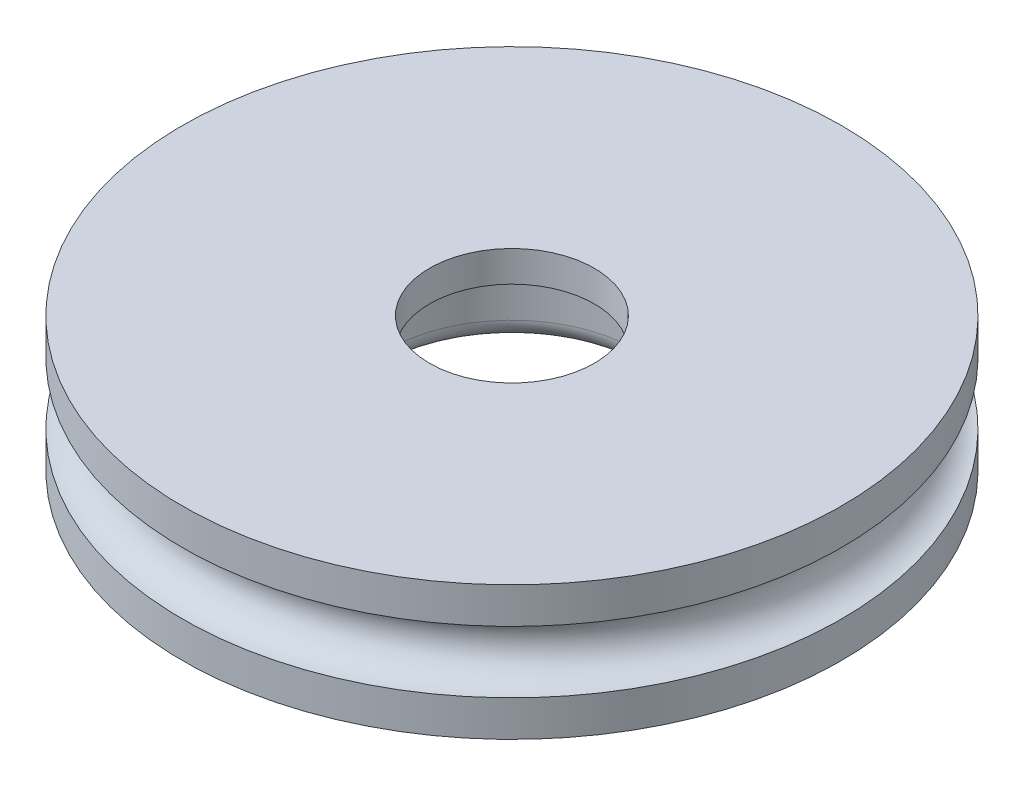
from build123d import *

# Parameters (mm, degrees)
SKETCH1_R           = 8
SKETCH1_R_2         = 3.05
BOSS_EXTRUDE1_DEPTH = 1.625
SKETCH3_R           = 3.5
SKETCH3_R_2         = 2
BOSS_EXTRUDE2_DEPTH = 0.75
SKETCH4_R           = 6.5
SKETCH4_R_2         = 3
CUT_EXTRUDE1_DEPTH  = 0.5
FILLET1_R           = 0.5


with BuildPart() as part:
    # Sketch1 → Boss-Extrude1 (new, symmetric)
    with BuildSketch(Plane(origin=(0, 0, 0), x_dir=(1, 0, 0), z_dir=(0, 1, 0))):
        with Locations(Location((0, 0, 0), (0, 0, 90))):
            Circle(SKETCH1_R)
        with Locations(Location((0, 0, 0), (0, 0, 90))):
            Circle(SKETCH1_R_2, mode=Mode.SUBTRACT)
    extrude(amount=BOSS_EXTRUDE1_DEPTH, both=True)

    # Sketch2 → Cut-Revolve1 (revolve, cut)
    with BuildSketch(Plane(origin=(0, 0, 0), x_dir=(0, 0, -1), z_dir=(1, 0, 0)), mode=Mode.PRIVATE) as cut_revolve1_sk:
        with BuildLine():
            Line((-8, 0.75), (-8, -0.75))
            ThreePointArc((-8, -0.75), (-7.25, 0), (-8, 0.75))
        make_face()
    revolve(cut_revolve1_sk.sketch.rotate(Axis((0, 1.625, 0), (0, -1, 0)), 180), axis=Axis((0, 1.625, 0), (0, -1, 0)), mode=Mode.SUBTRACT)

    # Sketch3 → Boss-Extrude2 (add)
    with BuildSketch(Plane(origin=(0, 1.625, 0), x_dir=(1, 0, 0), z_dir=(0, 1, 0))):
        Circle(SKETCH3_R)
        with Locations(Location((0, 0, 0), (0, 0, 270))):
            Circle(SKETCH3_R_2, mode=Mode.SUBTRACT)
    extrude(amount=-BOSS_EXTRUDE2_DEPTH)

    # Sketch4 → Cut-Extrude1 (cut)
    with BuildSketch(Plane.XZ.offset(1.625)):
        with Locations(Location((0, 0, 0), (0, 0, 270))):
            Circle(SKETCH4_R)
        Circle(SKETCH4_R_2, mode=Mode.SUBTRACT)
    extrude(amount=-CUT_EXTRUDE1_DEPTH, mode=Mode.SUBTRACT)

    # Fillet1
    fillet1_edges = [part.edges().sort_by_distance(p)[0] for p in [
        (0, 0.875, 3.05),
        (0, -1.125, 3.05),
    ]]
    fillet(fillet1_edges, radius=FILLET1_R)


solid = part.part
